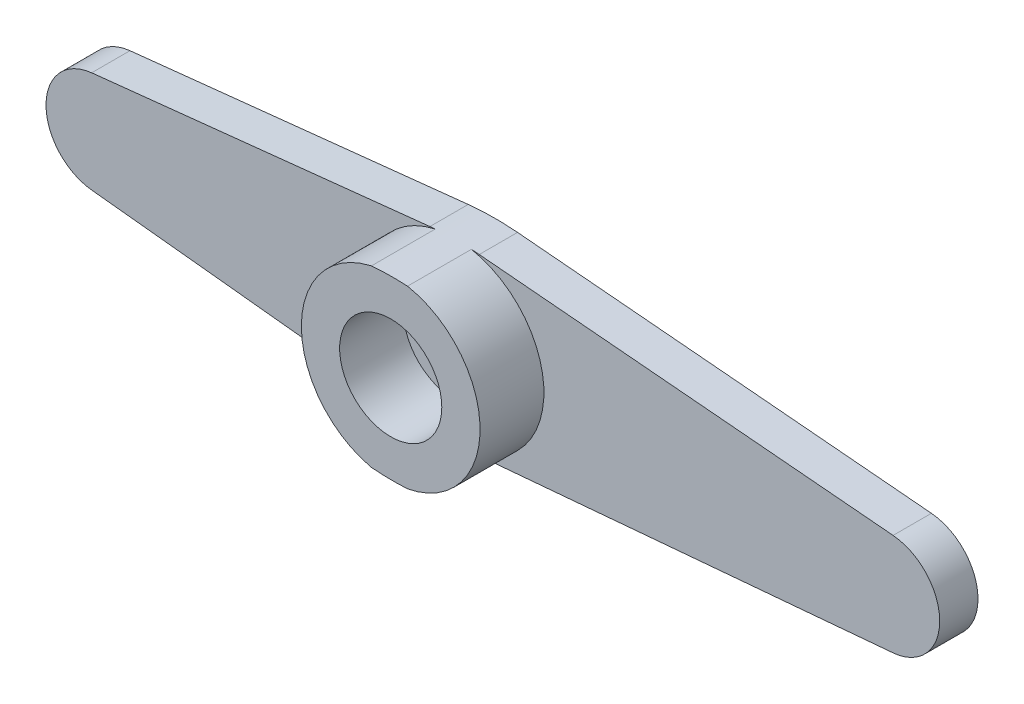
from build123d import *

# Parameters (mm, degrees)
BOSS_EXTRUDE1_DEPTH = 1.5
SKETCH1_3_R         = 2
BOSS_EXTRUDE2_DEPTH = 4


with BuildPart() as part:
    # Sketch1 → Boss-Extrude1 (new body)
    with BuildSketch(Plane.XY):
        with BuildLine():
            Line((-0.965077795, 3.3973761), (-14.211482552, 1.988787352))
            ThreePointArc((-14.211482552, 1.988787352), (-16, 0), (-14.211482552, -1.988787352))
            Line((-14.211482552, -1.988787352), (-0.965077795, -3.3973761))
            ThreePointArc((-0.965077795, -3.3973761), (0.000431807, -3.453017023), (0.966800983, -3.415131426))
            Line((0.966800983, -3.415131426), (17.174893203, -1.992338417))
            ThreePointArc((17.174893203, -1.992338417), (19, 0), (17.174893203, 1.992338417))
            Line((17.174893203, 1.992338417), (0.966800983, 3.415131426))
            ThreePointArc((0.966800983, 3.415131426), (0.000431807, 3.453017023), (-0.965077795, 3.3973761))
        make_face()
    extrude(amount=BOSS_EXTRUDE1_DEPTH)

    # Sketch1<3> → Boss-Extrude2 (add)
    with BuildSketch(Plane.XY):
        with BuildLine():
            ThreePointArc((0.65921534, 3.437358744), (-0.048694481, 3.452444827), (-0.755897232, 3.417399505))
            ThreePointArc((-0.755897232, 3.417399505), (-3.5, 0), (-0.755897232, -3.417399505))
            ThreePointArc((-0.755897232, -3.417399505), (-0.048694481, -3.452444827), (0.65921534, -3.437358744))
            ThreePointArc((0.65921534, -3.437358744), (2.697893038, -2.229657632), (3.5, 0))
            ThreePointArc((3.5, 0), (2.697893038, 2.229657632), (0.65921534, 3.437358744))
        make_face()
        Circle(SKETCH1_3_R, mode=Mode.SUBTRACT)
    extrude(amount=BOSS_EXTRUDE2_DEPTH)


solid = part.part
